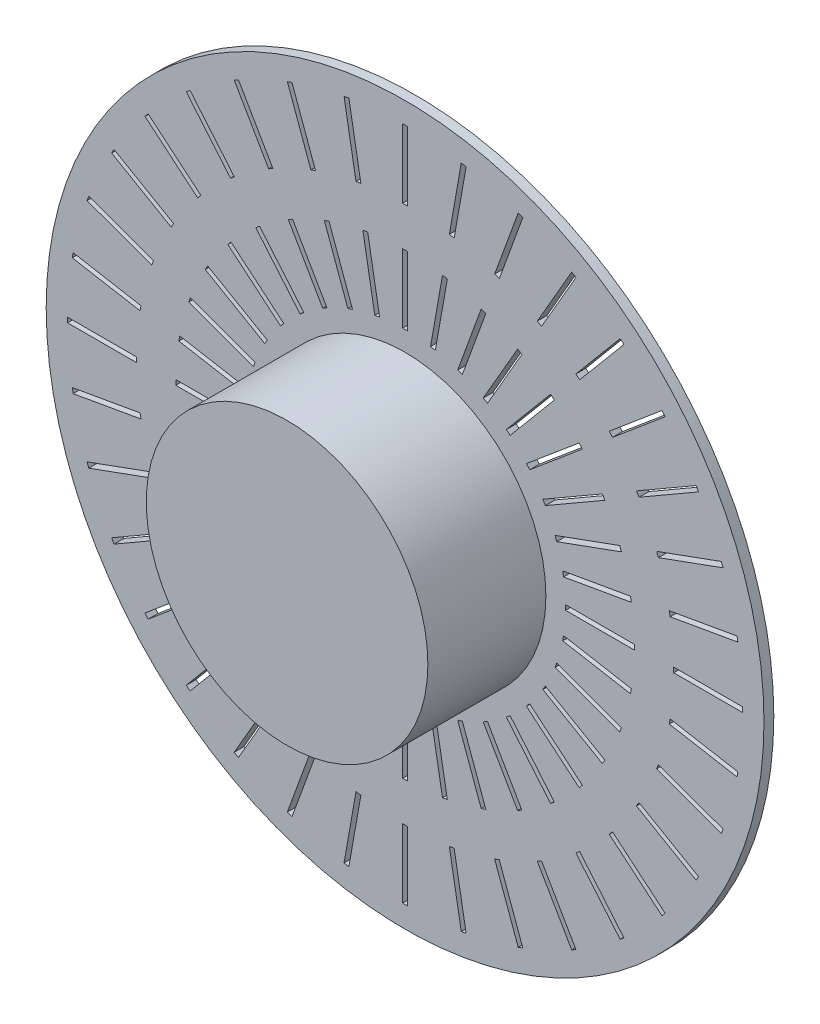
from build123d import *

# Parameters (mm, degrees)
ESQUISSE1_R                  = 365
BOSS_EXTRU_1_DEPTH           = 10
ESQUISSE2_R                  = 143.2
BOSS_EXTRU_2_DEPTH           = 120
ESQUISSE4_W                  = 5
ESQUISSE4_H                  = 70
ENL_V_MAT_EXTRU_1_DEPTH      = 530.952828089
R_P_TITION_CIRCULAIRE1_COUNT = 36


with BuildPart() as part:
    # Esquisse1 → Boss.-Extru.1 (new body)
    with BuildSketch(Plane.XY):
        Circle(ESQUISSE1_R)
    extrude(amount=BOSS_EXTRU_1_DEPTH)

    # Esquisse2 → Boss.-Extru.2 (add)
    with BuildSketch(Plane.XY.offset(10)):
        Circle(ESQUISSE2_R)
    extrude(amount=BOSS_EXTRU_2_DEPTH)

    # Esquisse4 → Enlèv. mat.-Extru.1 (cut, through all)
    with BuildSketch(Plane.XY.offset(10)):
        with Locations((0, -308.2)):
            Rectangle(ESQUISSE4_W, ESQUISSE4_H)
        with Locations((0, -198.2)):
            Rectangle(ESQUISSE4_W, ESQUISSE4_H)
    enl_v_mat_extru_1 = extrude(amount=-ENL_V_MAT_EXTRU_1_DEPTH, mode=Mode.SUBTRACT)

    # Répétition circulaire1: Enlèv. mat.-Extru.1 ×36 about axis
    r_p_tition_circulaire1_axis = Axis((0, 0, 0), (0, 0, 1))
    for i in range(1, R_P_TITION_CIRCULAIRE1_COUNT):
        add(enl_v_mat_extru_1.rotate(r_p_tition_circulaire1_axis, i * 360 / R_P_TITION_CIRCULAIRE1_COUNT), mode=Mode.SUBTRACT)


solid = part.part
